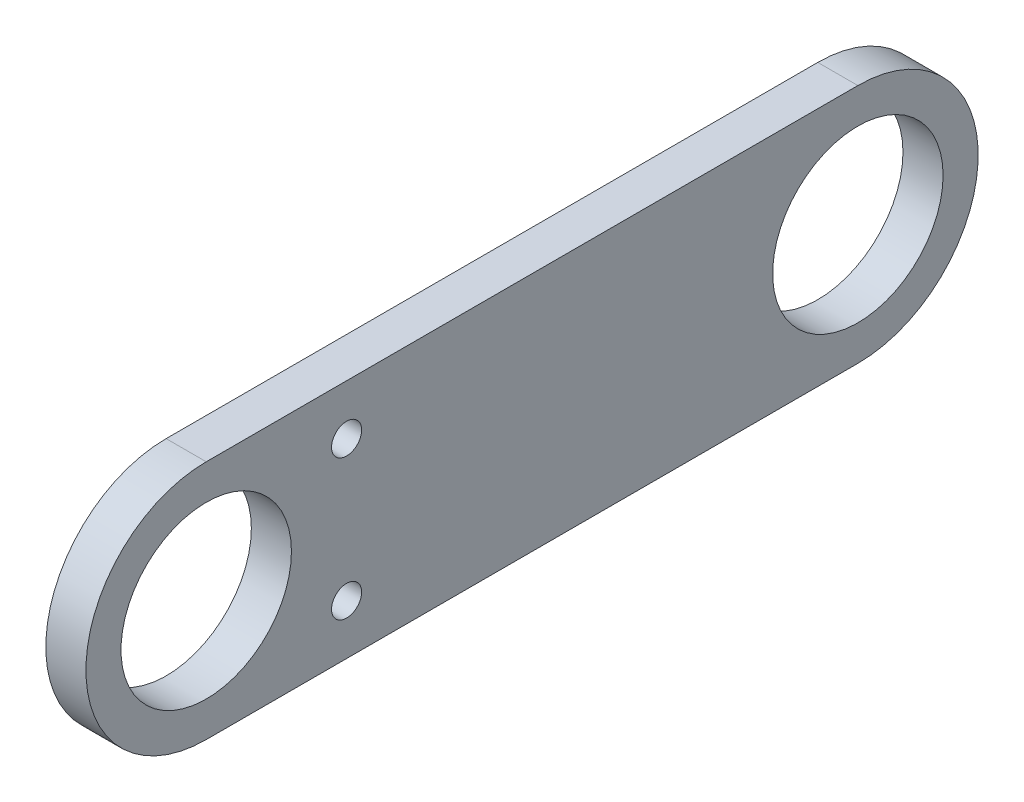
from build123d import *

# Parameters (mm, degrees)
SKETCH_1_R      = 8.5
SKETCH_1_R_2    = 1.5
EXTRUDE_1_DEPTH = 4


with BuildPart() as part:
    # 草图1 → 凸台-拉伸1 (new body)
    with BuildSketch(Plane(origin=(0, 0, 0), x_dir=(0, 0, -1), z_dir=(1, 0, 0))):
        with BuildLine():
            Line((-9, 12), (0, 12))
            Line((0, 12), (56, 12))
            ThreePointArc((56, 12), (68, 0), (56, -12))
            Line((56, -12), (0, -12))
            Line((0, -12), (-9, -12))
            ThreePointArc((-9, -12), (-21, 0), (-9, 12))
        make_face()
        with Locations((56, 0)):
            Circle(SKETCH_1_R, mode=Mode.SUBTRACT)
        with Locations((5, 7)):
            Circle(SKETCH_1_R_2, mode=Mode.SUBTRACT)
        with Locations((5, -7)):
            Circle(SKETCH_1_R_2, mode=Mode.SUBTRACT)
        with Locations((-9, 0)):
            Circle(SKETCH_1_R, mode=Mode.SUBTRACT)
    extrude(amount=EXTRUDE_1_DEPTH)


solid = part.part
